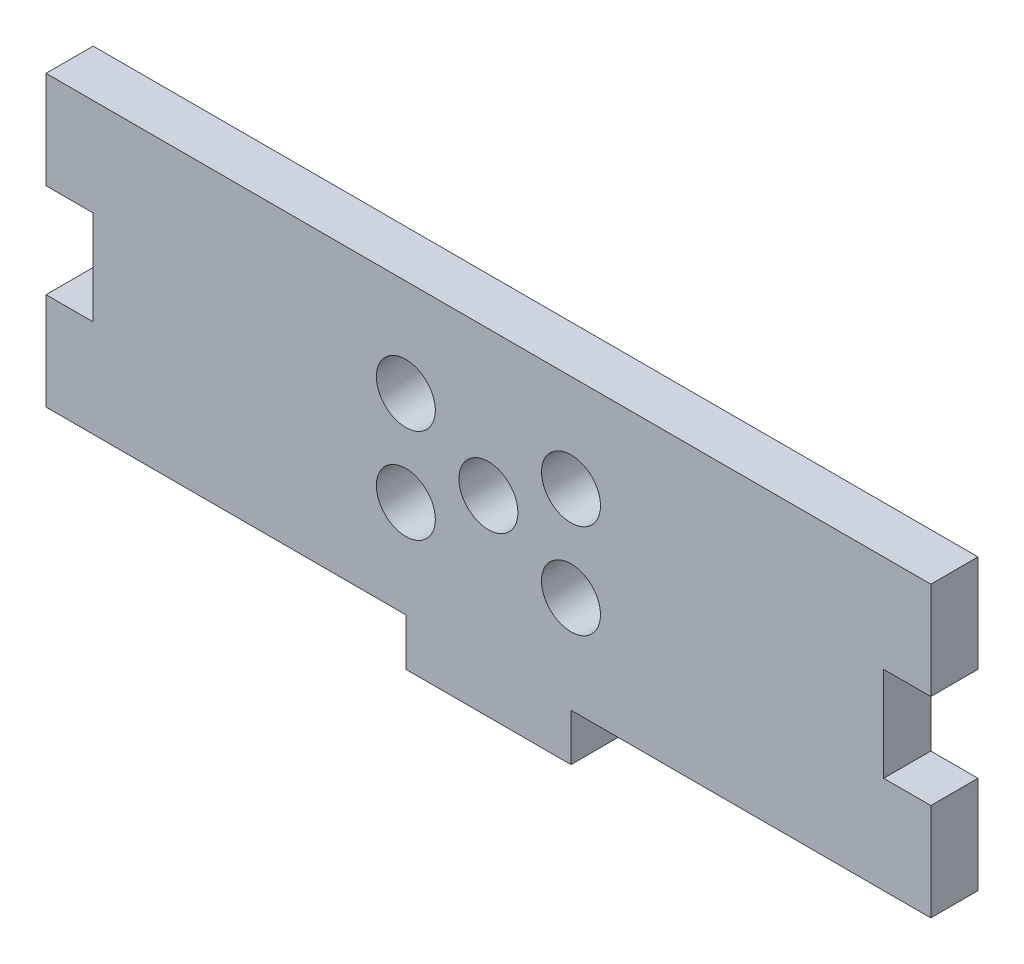
from build123d import *

# Parameters (mm, degrees)
CROQUIS1_R              = 2.5
SALIENTE_EXTRUIR1_DEPTH = 4


with BuildPart() as part:
    # Croquis1 → Saliente-Extruir1 (new body)
    with BuildSketch(Plane.XY):
        Polygon((37.5, 12.25), (-37.5, 12.25), (-37.5, 4), (-33.5, 4), (-33.5, -4), (-37.5, -4), (-37.5, -12.25), (-7, -12.25), (-7, -16.25), (7, -16.25), (7, -12.25), (37.5, -12.25), (37.5, -4), (33.5, -4), (33.5, 4), (37.5, 4), align=None)
        Circle(CROQUIS1_R, mode=Mode.SUBTRACT)
        with Locations((7, 4)):
            Circle(CROQUIS1_R, mode=Mode.SUBTRACT)
        with Locations(Location((7, -4, 0), (0, 0, 180))):
            Circle(CROQUIS1_R, mode=Mode.SUBTRACT)
        with Locations((-7, -4)):
            Circle(CROQUIS1_R, mode=Mode.SUBTRACT)
        with Locations(Location((-7, 4, 0), (0, 0, 180))):
            Circle(CROQUIS1_R, mode=Mode.SUBTRACT)
    extrude(amount=SALIENTE_EXTRUIR1_DEPTH)


solid = part.part
